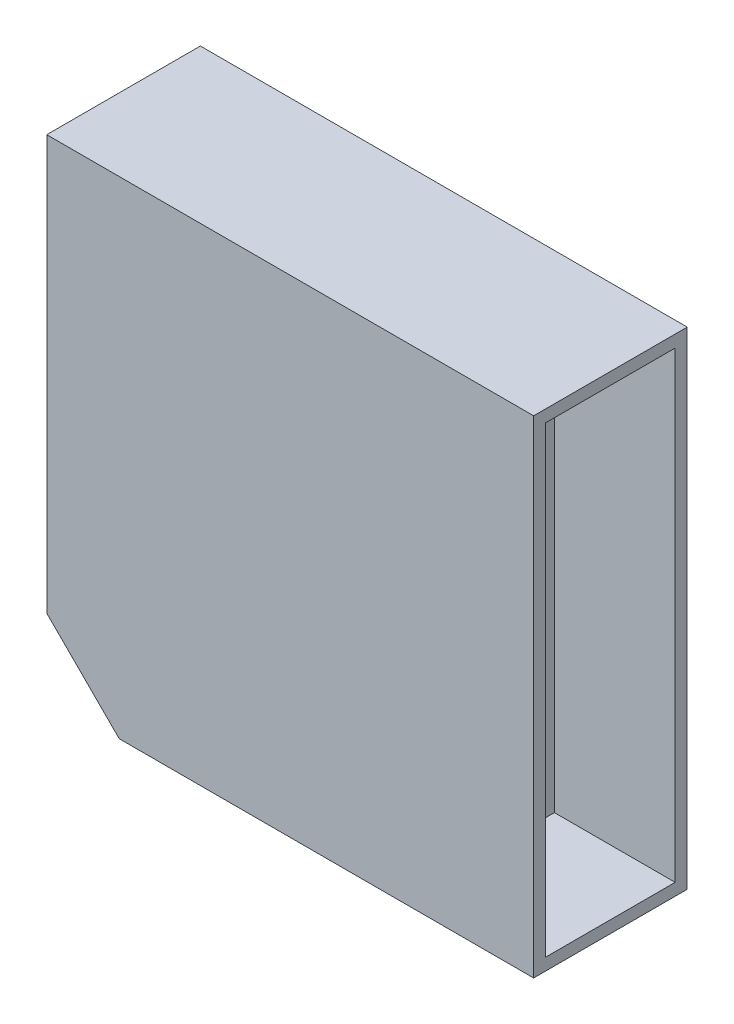
from build123d import *

# Parameters (mm, degrees)
SKETCH_1_W          = 20.16
SKETCH_1_H          = 20.16
EXTRUDE_1_DEPTH     = 6.36
SKETCH_2_W          = 5.36
SKETCH_2_H          = 19.16
CUT_EXTRUDE_1_DEPTH = 5
CHAMFER_1_SIZE      = 3


with BuildPart() as part:
    # 草图1 → 凸台-拉伸1 (new body)
    with BuildSketch(Plane.XY):
        Rectangle(SKETCH_1_W, SKETCH_1_H)
    extrude(amount=EXTRUDE_1_DEPTH)

    # 草图2 → 切除-拉伸1 (cut)
    with BuildSketch(Plane(origin=(10.08, 0, 0), x_dir=(0, 0, -1), z_dir=(1, 0, 0))):
        with Locations((-3.18, 0)):
            Rectangle(SKETCH_2_W, SKETCH_2_H)
    extrude(amount=-CUT_EXTRUDE_1_DEPTH, mode=Mode.SUBTRACT)

    # 倒角1
    chamfer_1_edges = [part.edges().sort_by_distance(p)[0] for p in [
        (-10.08, -10.08, 3.18),
    ]]
    chamfer(chamfer_1_edges, length=CHAMFER_1_SIZE)


solid = part.part
